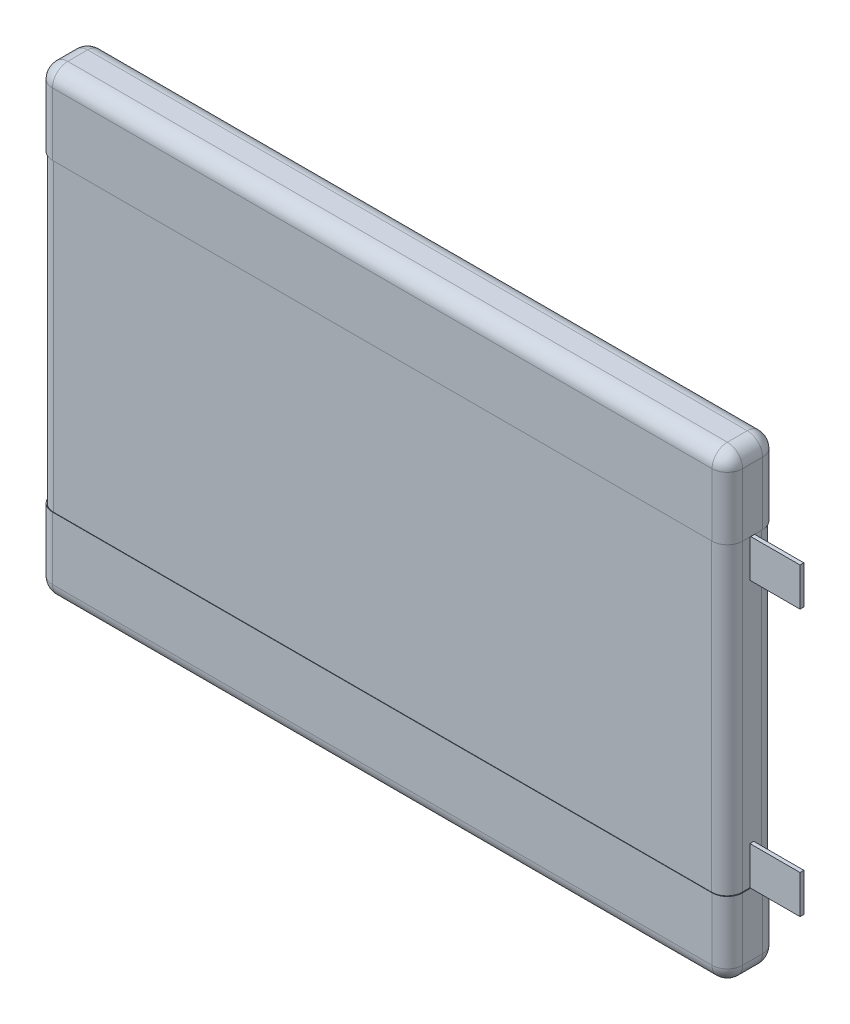
from build123d import *

# Parameters (mm, degrees)
SKETCH_1_W           = 90
SKETCH_1_H           = 60
EXTRUDE_1_DEPTH      = 6.5
EXTRUDE_2_DEPTH      = 0.05
EXTRUDE_2_DEPTH_BACK = 6.55
SKETCH_2_W           = 90.2
SKETCH_2_H           = 10.2
SKETCH_3_W           = 0.5
SKETCH_3_H           = 5
EXTRUDE_3_DEPTH      = 6.55
FILLET_1_R           = 2


with BuildPart() as part:
    # Эскиз1 → Бобышка-Вытянуть1 (new body)
    with BuildSketch(Plane.XY):
        with Locations((45, 30)):
            Rectangle(SKETCH_1_W, SKETCH_1_H)
    extrude(amount=EXTRUDE_1_DEPTH)

    # Эскиз2 → Бобышка-Вытянуть2 (add, two sides: drawn at the far end of the back side and taken through both)
    with BuildSketch(Plane.XY.offset(6.5).offset(-EXTRUDE_2_DEPTH_BACK)):
        with Locations((45, 55)):
            Rectangle(SKETCH_2_W, SKETCH_2_H)
        with Locations((45, 5)):
            Rectangle(SKETCH_2_W, SKETCH_2_H)
    extrude(amount=EXTRUDE_2_DEPTH + EXTRUDE_2_DEPTH_BACK)

    # Эскиз3 → Бобышка-Вытянуть3 (add)
    with BuildSketch(Plane(origin=(90, 0, 0), x_dir=(0, 0, -1), z_dir=(1, 0, 0))):
        with Locations((-3.25, 47.4)):
            Rectangle(SKETCH_3_W, SKETCH_3_H)
        with Locations((-3.25, 12.6)):
            Rectangle(SKETCH_3_W, SKETCH_3_H)
    extrude(amount=EXTRUDE_3_DEPTH)

    # Скругление1
    fillet_1_edges = [part.edges().sort_by_distance(p)[0] for p in [
        (-0.1, 60.1, 3.25),
        (-0.1, -0.1, 3.25),
        (90.1, -0.1, 3.25),
        (90.1, 60.1, 3.25),
        (90.1, 55, -0.05),
        (90.1, 55, 6.55),
        (90, 30, 0),
        (90, 30, 6.5),
        (90.1, 5, -0.05),
        (90.1, 5, 6.55),
        (-0.1, 5, 6.55),
        (0, 30, 6.5),
        (-0.1, 55, 6.55),
        (-0.1, 55, -0.05),
        (0, 30, 0),
        (-0.1, 5, -0.05),
        (45, -0.1, 6.55),
        (45, -0.1, -0.05),
        (45, 60.1, 6.55),
        (45, 60.1, -0.05),
    ]]
    fillet(fillet_1_edges, radius=FILLET_1_R)


solid = part.part
